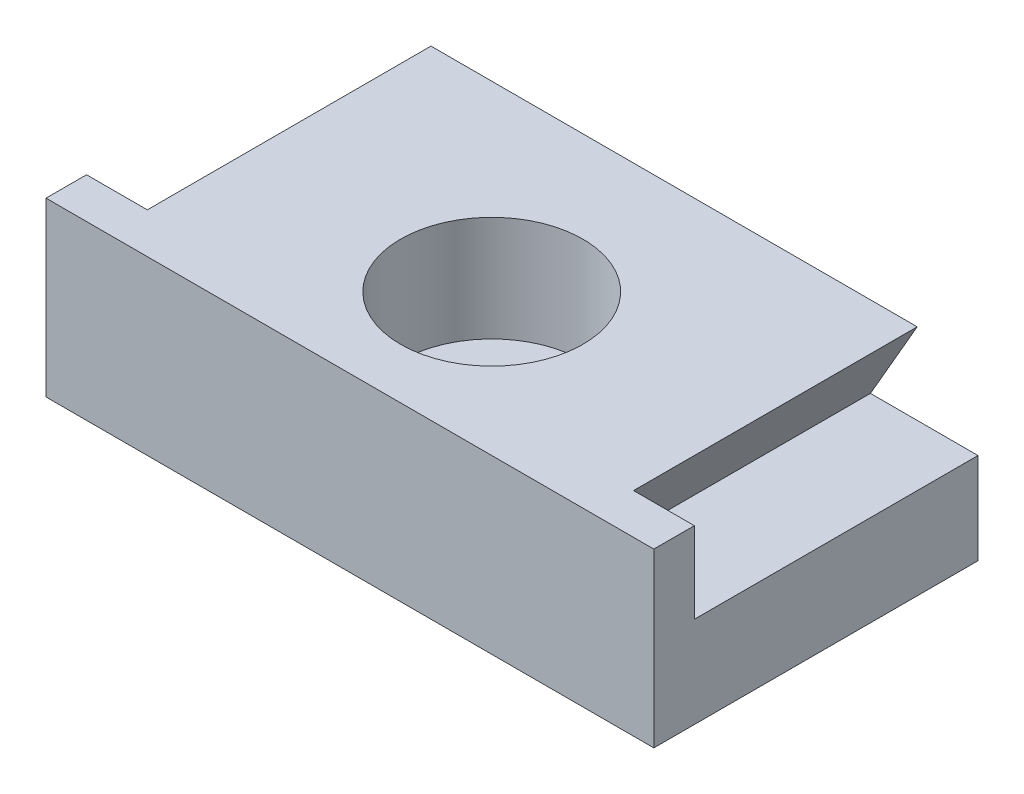
from build123d import *

# Parameters (mm, degrees)
SKETCH1_W           = 30
SKETCH1_H           = 16
BOSS_EXTRUDE1_DEPTH = 8.5
SKETCH2_R           = 4.5
CUT_EXTRUDE1_DEPTH  = 5.2
SKETCH3_R           = 2.65
CUT_EXTRUDE2_DEPTH  = 35.395348523
CUT_EXTRUDE3_DEPTH  = 14
SKETCH5_R           = 2.1
CUT_EXTRUDE4_DEPTH  = 7
SKETCH6_R           = 1.1
CUT_EXTRUDE5_DEPTH  = 2.5


with BuildPart() as part:
    # Sketch1 → Boss-Extrude1 (new body)
    with BuildSketch(Plane(origin=(0, 0, 0), x_dir=(1, 0, 0), z_dir=(0, 1, 0))):
        with Locations((15, 8)):
            Rectangle(SKETCH1_W, SKETCH1_H)
    extrude(amount=BOSS_EXTRUDE1_DEPTH)

    # Sketch2 → Cut-Extrude1 (cut)
    with BuildSketch(Plane(origin=(0, 8.5, 0), x_dir=(1, 0, 0), z_dir=(0, 1, 0))):
        with Locations(Location((15, 7, 0), (0, 0, 270))):
            Circle(SKETCH2_R)
    extrude(amount=-CUT_EXTRUDE1_DEPTH, mode=Mode.SUBTRACT)

    # Sketch3 → Cut-Extrude2 (cut, through all)
    with BuildSketch(Plane(origin=(0, 3.3, 0), x_dir=(1, 0, 0), z_dir=(0, 1, 0))):
        with Locations(Location((15, 7, 0), (0, 0, 270))):
            Circle(SKETCH3_R)
    extrude(amount=-CUT_EXTRUDE2_DEPTH, mode=Mode.SUBTRACT)

    # Sketch4 → Cut-Extrude3 (cut)
    with BuildSketch(Plane(origin=(0, 0, -16), x_dir=(-1, 0, 0), z_dir=(0, 0, -1))):
        Polygon((-27, 8.5), (-24.68995278, 4.498880847), (-30, 4.498880847), (-30, 8.5), align=None)
        Polygon((0, 8.5), (-3, 8.5), (-5.31004722, 4.498880847), (0, 4.498880847), align=None)
    extrude(amount=-CUT_EXTRUDE3_DEPTH, mode=Mode.SUBTRACT)

    # Sketch5 → Cut-Extrude4 (cut)
    with BuildSketch(Plane(origin=(0, 0, -16), x_dir=(-1, 0, 0), z_dir=(0, 0, -1))):
        with Locations((-21.5, 4.25)):
            Circle(SKETCH5_R)
        with Locations(Location((-8.5, 4.25, 0), (0, 0, 180))):
            Circle(SKETCH5_R)
    extrude(amount=-CUT_EXTRUDE4_DEPTH, mode=Mode.SUBTRACT)

    # Sketch6 → Cut-Extrude5 (cut)
    with BuildSketch(Plane.XZ):
        with Locations(Location((10.119225975, -7, 0), (0, 0, 270))):
            Circle(SKETCH6_R)
        with Locations(Location((19.880774025, -7, 0), (0, 0, 270))):
            Circle(SKETCH6_R)
    extrude(amount=-CUT_EXTRUDE5_DEPTH, mode=Mode.SUBTRACT)


solid = part.part
